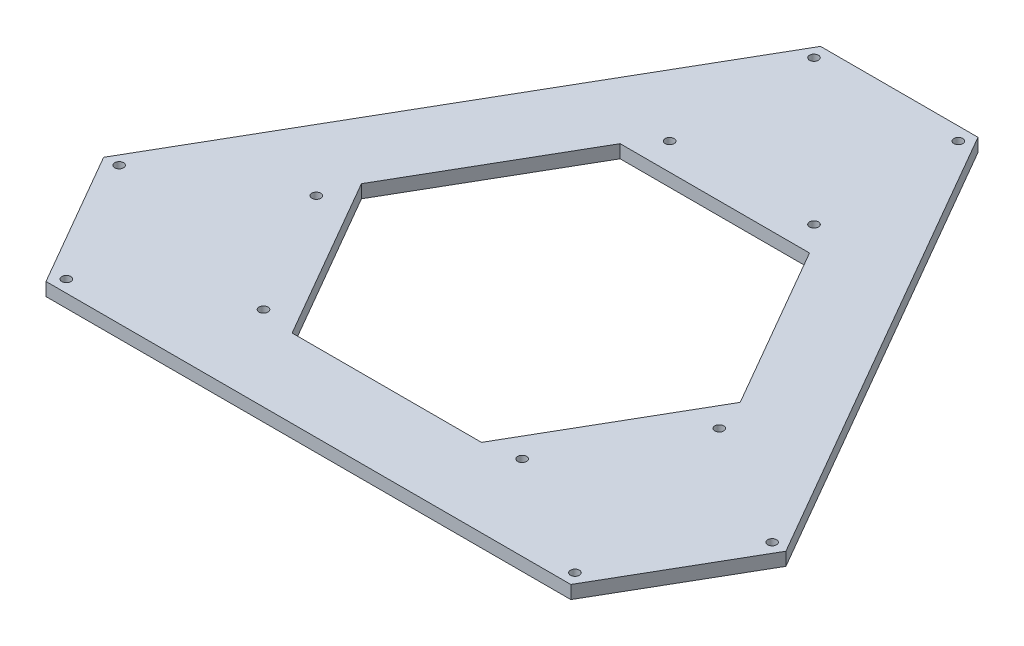
from build123d import *

# Parameters (mm, degrees)
SKETCH1_R           = 1.7
BOSS_EXTRUDE1_DEPTH = 5


with BuildPart() as part:
    # Sketch1 → Boss-Extrude1 (new body)
    with BuildSketch(Plane(origin=(0, 0, 0), x_dir=(1, 0, 0), z_dir=(0, 1, 0))):
        Polygon((-30, 132.790561914), (30, 132.790561914), (130, -40.414518843), (100, -92.37604307), (-100, -92.37604307), (-130, -40.414518843), align=None)
        with Locations(Location((-27.5, 127.790561914, 0), (0, 0, 270))):
            Circle(SKETCH1_R, mode=Mode.SUBTRACT)
        with Locations(Location((-27.5, 72.790561914, 0), (0, 0, 270))):
            Circle(SKETCH1_R, mode=Mode.SUBTRACT)
        with Locations(Location((27.5, 127.790561914, 0), (0, 0, 90))):
            Circle(SKETCH1_R, mode=Mode.SUBTRACT)
        with Locations(Location((27.5, 72.790561914, 0), (0, 0, 90))):
            Circle(SKETCH1_R, mode=Mode.SUBTRACT)
        with Locations(Location((76.788475773, -12.579582353, 0), (0, 0, 270))):
            Circle(SKETCH1_R, mode=Mode.SUBTRACT)
        with Locations(Location((49.288475773, -60.210979561, 0), (0, 0, 90))):
            Circle(SKETCH1_R, mode=Mode.SUBTRACT)
        with Locations(Location((96.919872981, -87.710979561, 0), (0, 0, 90))):
            Circle(SKETCH1_R, mode=Mode.SUBTRACT)
        with Locations(Location((124.419872981, -40.079582353, 0), (0, 0, 270))):
            Circle(SKETCH1_R, mode=Mode.SUBTRACT)
        with Locations(Location((-49.288475773, -60.210979561, 0), (0, 0, 270))):
            Circle(SKETCH1_R, mode=Mode.SUBTRACT)
        with Locations(Location((-76.788475773, -12.579582353, 0), (0, 0, 90))):
            Circle(SKETCH1_R, mode=Mode.SUBTRACT)
        with Locations(Location((-124.419872981, -40.079582353, 0), (0, 0, 90))):
            Circle(SKETCH1_R, mode=Mode.SUBTRACT)
        with Locations(Location((-96.919872981, -87.710979561, 0), (0, 0, 270))):
            Circle(SKETCH1_R, mode=Mode.SUBTRACT)
        Polygon((-72.168783649, 0), (-36.084391824, -62.5), (36.084391824, -62.5), (72.168783649, 0), (36.084391824, 62.5), (-36.084391824, 62.5), align=None, mode=Mode.SUBTRACT)
    extrude(amount=BOSS_EXTRUDE1_DEPTH)


solid = part.part
